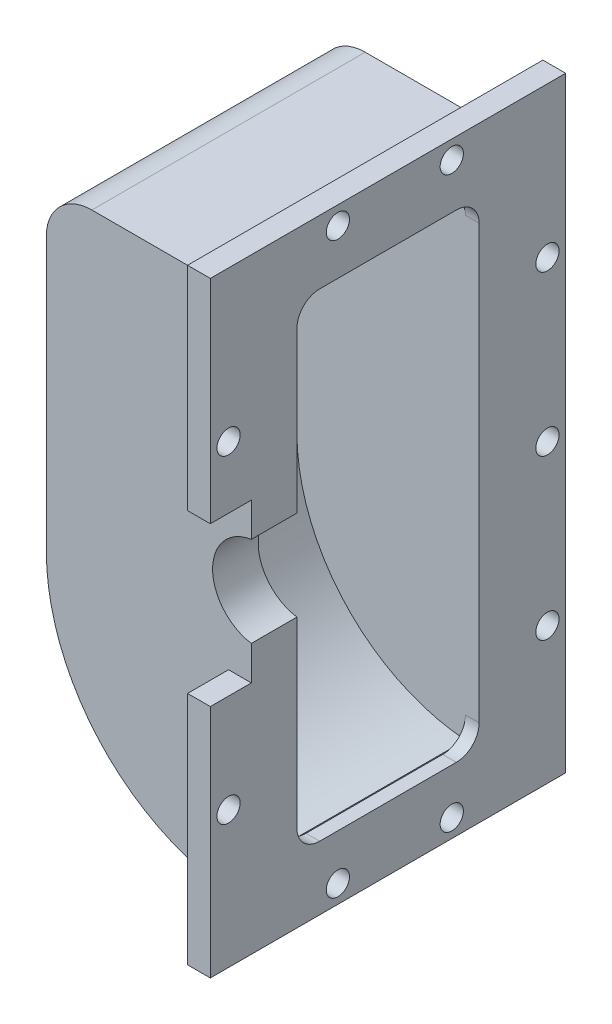
from build123d import *
from build123d.topology import SkipClean

# Parameters (mm, degrees)
BOSS_EXTRUDE2_DEPTH     = 120
CUT_EXTRUDE1_DEPTH      = 10
CUT_EXTRUDE1_DEPTH_BACK = 18
BOSS_EXTRUDE3_DEPTH     = 10
F_1_0MM_DOWEL_HOLE1_D   = 10.2
SKETCH8_W               = 18
SKETCH8_H               = 69.5
CUT_EXTRUDE2_DEPTH      = 10
CUT_EXTRUDE3_START      = -20
CUT_EXTRUDE3_DEPTH      = 20
CUT_EXTRUDE4_DEPTH      = 80
CUT_EXTRUDE5_DEPTH      = 6


with BuildPart() as part:
    # Sketch2 → Boss-Extrude2 (new body)
    with BuildSketch(Plane.XY):
        with BuildLine():
            Line((0, -67.773719933), (0, -28))
            Line((0, -28), (-60, -28))
            ThreePointArc((-60, -28), (-74.142135624, -33.857864376), (-80, -48))
            Line((-80, -48), (-80, -157.773719933))
            ThreePointArc((-80, -157.773719933), (-56.568542495, -214.342262428), (0, -237.773719933))
            Line((0, -237.773719933), (0, -147.773719933))
            Line((0, -147.773719933), (0, -108.226280067))
            Line((0, -108.226280067), (0, -77.773719933))
            Line((0, -77.773719933), (0, -67.773719933))
        make_face()
        with BuildLine():
            Line((0, -28), (0, 0))
            Line((0, 0), (-10, 0))
            Line((-10, 0), (-10, -18))
            Line((-10, -18), (-70, -18))
            ThreePointArc((-70, -18), (-84.142135624, -23.857864376), (-90, -38))
            Line((-90, -38), (-90, -157.773719933))
            ThreePointArc((-90, -157.773719933), (-67.082039325, -217.773719933), (-10, -247.216439033))
            Line((-10, -247.216439033), (-10, -266))
            Line((-10, -266), (0, -266))
            Line((0, -266), (0, -237.773719933))
            ThreePointArc((0, -237.773719933), (-56.568542495, -214.342262428), (-80, -157.773719933))
            Line((-80, -157.773719933), (-80, -48))
            ThreePointArc((-80, -48), (-74.142135624, -33.857864376), (-60, -28))
            Line((-60, -28), (0, -28))
        make_face()
    extrude(amount=BOSS_EXTRUDE2_DEPTH)

    # Sketch3 → Cut-Extrude1 (cut, two sides: drawn at the far end of the back side and taken through both)
    with BuildSketch(Plane.XY.offset(120).offset(-CUT_EXTRUDE1_DEPTH_BACK)):
        with BuildLine():
            Line((0, -147.773719933), (0, -108.226280067))
            ThreePointArc((0, -108.226280067), (-17, -128), (0, -147.773719933))
        make_face()
    extrude(amount=CUT_EXTRUDE1_DEPTH + CUT_EXTRUDE1_DEPTH_BACK, mode=Mode.SUBTRACT)

    # Sketch5 → Boss-Extrude3 (add)
    with BuildSketch(Plane.ZY.offset(10)):
        Polygon((0, -266), (-18, -266), (-18, 0), (138, 0), (138, -266), (120, -266), align=None)
    extrude(amount=-BOSS_EXTRUDE3_DEPTH)

    # Ø1.0mm Dowel Hole1 (through all)
    with Locations(Plane.ZY.offset(10)):
        with Locations((32, -8), (82, -8), (-10, -66), (-10, -136), (-10, -206), (32, -258), (82, -258), (130, -206), (130, -66)):
            Hole(F_1_0MM_DOWEL_HOLE1_D / 2)

    # Sketch8 → Cut-Extrude2 (cut)
    with BuildSketch(Plane.ZY.offset(10)):
        with Locations((129, -128.05)):
            Rectangle(SKETCH8_W, SKETCH8_H)
    extrude(amount=-CUT_EXTRUDE2_DEPTH, mode=Mode.SUBTRACT)

    # Sketch9 → Cut-Extrude3 (cut)
    with SkipClean():  # the faces are left unmerged after this step: merging them gives an invalid solid
        with BuildSketch(Plane.XY.offset(120).offset(CUT_EXTRUDE3_START)):
            with BuildLine():
                Line((0, -147.773719933), (0, -108.226280067))
                ThreePointArc((0, -108.226280067), (-5.320621257, -109.812991947), (-10, -112.801315846))
                Line((-10, -112.801315846), (-10, -143.198684154))
                ThreePointArc((-10, -143.198684154), (-5.320621257, -146.187008053), (0, -147.773719933))
            make_face()
            with BuildLine():
                ThreePointArc((-10, -143.198684154), (-17, -128), (-10, -112.801315846))
                Line((-10, -112.801315846), (-10, -143.198684154))
            make_face()
        extrude(amount=CUT_EXTRUDE3_DEPTH, mode=Mode.SUBTRACT)

    # Sketch12 → Cut-Extrude4 (cut)
    with BuildSketch(Plane(origin=(0, 0, 20), x_dir=(-1, 0, 0), z_dir=(0, 0, -1))):
        with BuildLine():
            Line((60, -28), (6, -28))
            Line((6, -28), (6, -237.548402634))
            ThreePointArc((6, -237.548402634), (58.651513194, -212.179601968), (80, -157.773719933))
            Line((80, -157.773719933), (80, -48))
            ThreePointArc((80, -48), (74.142135624, -33.857864376), (60, -28))
        make_face()
    extrude(amount=-CUT_EXTRUDE4_DEPTH, mode=Mode.SUBTRACT)

    # Sketch10 → Cut-Extrude5 (cut)
    with BuildSketch(Plane(origin=(0, 0, 0), x_dir=(0, 0, -1), z_dir=(1, 0, 0))):
        with BuildLine():
            Line((-30, -238), (-90, -238))
            ThreePointArc((-90, -238), (-97.071067812, -235.071067812), (-100, -228))
            Line((-100, -228), (-100, -38))
            ThreePointArc((-100, -38), (-97.071067812, -30.928932188), (-90, -28))
            Line((-90, -28), (-30, -28))
            ThreePointArc((-30, -28), (-22.928932188, -30.928932188), (-20, -38))
            Line((-20, -38), (-20, -228))
            ThreePointArc((-20, -228), (-22.928932188, -235.071067812), (-30, -238))
        make_face()
    extrude(amount=-CUT_EXTRUDE5_DEPTH, mode=Mode.SUBTRACT)


solid = part.part
